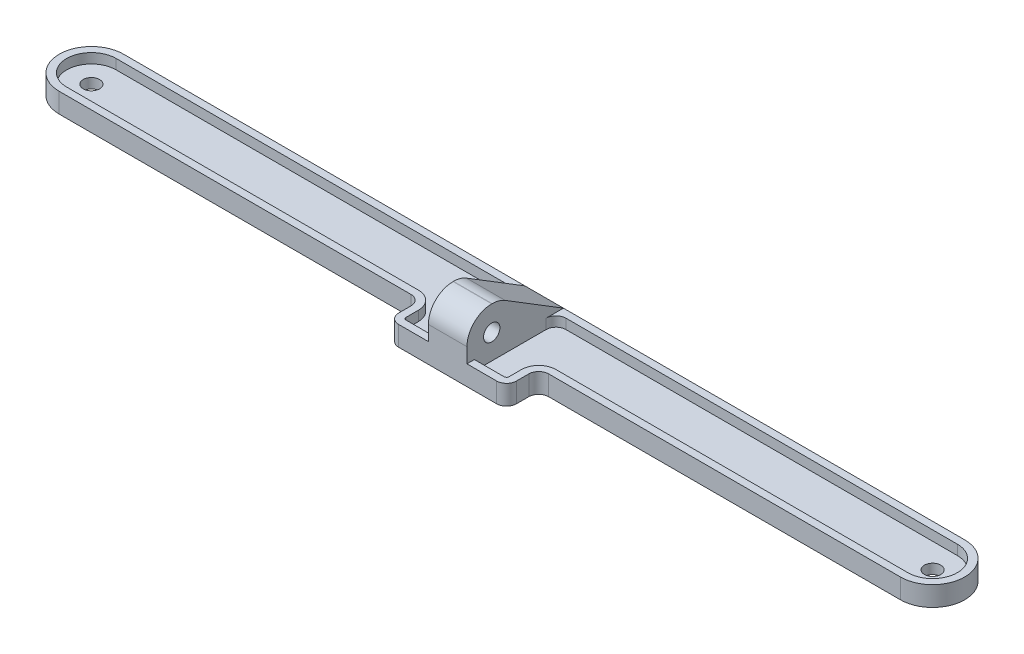
from build123d import *

# Parameters (mm, degrees)
SKETCH1_R               = 1.65
BOSS_EXTRUDE1_DEPTH     = 1
SKETCH2_W               = 7.8
SKETCH2_H               = 13
BOSS_EXTRUDE2_DEPTH     = 10
BOSS_EXTRUDE3_DEPTH     = 7.8
CUT_EXTRUDE1_DEPTH      = 97.907997606
CUT_EXTRUDE1_DEPTH_BACK = 97.907997606
SKETCH4_R               = 1.65
SKETCH7_W               = 8
SKETCH7_H               = 6.5
BOSS_EXTRUDE5_DEPTH     = 2
FILLET3_R               = 2
BOSS_EXTRUDE4_DEPTH     = 2
CUT_EXTRUDE2_DEPTH      = 10
FILLET1_R               = 5
FILLET2_R               = 2


with BuildPart() as part:
    # Sketch1 → Boss-Extrude1 (new, symmetric)
    with BuildSketch(Plane(origin=(0, 0, 0), x_dir=(1, 0, 0), z_dir=(0, 1, 0))):
        with BuildLine():
            Line((-85, 6.5), (85, 6.5))
            ThreePointArc((85, 6.5), (91.5, 0), (85, -6.5))
            Line((85, -6.5), (-85, -6.5))
            ThreePointArc((-85, -6.5), (-91.5, 0), (-85, 6.5))
        make_face()
        with Locations(Location((-85, 0, 0), (0, 0, 270))):
            Circle(SKETCH1_R, mode=Mode.SUBTRACT)
        with Locations(Location((85, 0, 0), (0, 0, 270))):
            Circle(SKETCH1_R, mode=Mode.SUBTRACT)
    extrude(amount=BOSS_EXTRUDE1_DEPTH, both=True)

    # Sketch2 → Boss-Extrude2 (add)
    with BuildSketch(Plane(origin=(0, 1, 0), x_dir=(1, 0, 0), z_dir=(0, 1, 0))):
        Rectangle(SKETCH2_W, SKETCH2_H)
    extrude(amount=BOSS_EXTRUDE2_DEPTH)

    # Sketch3 → Boss-Extrude3 (add)
    with BuildSketch(Plane(origin=(3.9, 0, 0), x_dir=(0, 0, -1), z_dir=(1, 0, 0))):
        with BuildLine():
            Line((-6.5, 11), (-8, 11))
            ThreePointArc((-8, 11), (-11.535533906, 9.535533906), (-13, 6))
            Line((-13, 6), (-13, -1))
            Line((-13, -1), (-6.5, -1))
            Line((-6.5, -1), (-6.5, 11))
        make_face()
    extrude(amount=-BOSS_EXTRUDE3_DEPTH)

    # Sketch4 → Cut-Extrude1 (cut, two sides: drawn at the far end of the back side and taken through both)
    with BuildSketch(Plane(origin=(3.9, 0, 0), x_dir=(0, 0, -1), z_dir=(1, 0, 0)).offset(-CUT_EXTRUDE1_DEPTH_BACK)):
        with Locations((-8, 6)):
            Circle(SKETCH4_R)
    extrude(amount=CUT_EXTRUDE1_DEPTH + CUT_EXTRUDE1_DEPTH_BACK, mode=Mode.SUBTRACT)

    # Sketch7 → Boss-Extrude5 (add)
    with BuildSketch(Plane(origin=(0, 1, 0), x_dir=(1, 0, 0), z_dir=(0, 1, 0))):
        with Locations((-7.9, -9.75)):
            Rectangle(SKETCH7_W, SKETCH7_H)
        with Locations((7.9, -9.75)):
            Rectangle(SKETCH7_W, SKETCH7_H)
    extrude(amount=-BOSS_EXTRUDE5_DEPTH)

    # Fillet3
    fillet3_edges = [part.edges().sort_by_distance(p)[0] for p in [
        (-11.9, 0, 6.5),
        (-11.9, 0, 13),
        (11.9, 0, 6.5),
        (11.9, 0, 13),
    ]]
    fillet(fillet3_edges, radius=FILLET3_R)

    # Sketch5 → Boss-Extrude4 (add)
    with BuildSketch(Plane(origin=(0, 1, 0), x_dir=(1, 0, 0), z_dir=(0, 1, 0))):
        with BuildLine():
            Line((-85, 6.5), (85, 6.5))
            ThreePointArc((85, 6.5), (91.5, 0), (85, -6.5))
            Line((85, -6.5), (13.9, -6.5))
            ThreePointArc((13.9, -6.5), (12.485786438, -7.085786438), (11.9, -8.5))
            Line((11.9, -8.5), (11.9, -11))
            ThreePointArc((11.9, -11), (11.314213562, -12.414213562), (9.9, -13))
            Line((9.9, -13), (-9.9, -13))
            ThreePointArc((-9.9, -13), (-11.314213562, -12.414213562), (-11.9, -11))
            Line((-11.9, -11), (-11.9, -8.5))
            ThreePointArc((-11.9, -8.5), (-12.485786438, -7.085786438), (-13.9, -6.5))
            Line((-13.9, -6.5), (-85, -6.5))
            ThreePointArc((-85, -6.5), (-91.5, 0), (-85, 6.5))
        make_face()
        with BuildLine():
            Line((-85, 5), (85, 5))
            ThreePointArc((85, 5), (90, 0), (85, -5))
            Line((85, -5), (13.9, -5))
            ThreePointArc((13.9, -5), (11.425126266, -6.025126266), (10.4, -8.5))
            Line((10.4, -8.5), (10.4, -11))
            ThreePointArc((10.4, -11), (10.253553391, -11.353553391), (9.9, -11.5))
            Line((9.9, -11.5), (-9.9, -11.5))
            ThreePointArc((-9.9, -11.5), (-10.253553391, -11.353553391), (-10.4, -11))
            Line((-10.4, -11), (-10.4, -8.5))
            ThreePointArc((-10.4, -8.5), (-11.425126266, -6.025126266), (-13.9, -5))
            Line((-13.9, -5), (-85, -5))
            ThreePointArc((-85, -5), (-90, 0), (-85, 5))
        make_face(mode=Mode.SUBTRACT)
    extrude(amount=BOSS_EXTRUDE4_DEPTH)

    # Sketch6 → Cut-Extrude2 (cut)
    with BuildSketch(Plane.ZY.offset(3.9)):
        Polygon((-6.5, 3), (6.5, 11), (-6.5, 11), align=None)
    extrude(amount=-CUT_EXTRUDE2_DEPTH, mode=Mode.SUBTRACT)

    # Fillet1
    fillet1_edges = [part.edges().sort_by_distance(p)[0] for p in [
        (0, 11, 6.5),
    ]]
    fillet(fillet1_edges, radius=FILLET1_R)

    # Fillet2
    fillet2_edges = [part.edges().sort_by_distance(p)[0] for p in [
        (-3.9, 2, -5),
        (3.9, 2, -5),
    ]]
    fillet(fillet2_edges, radius=FILLET2_R)


solid = part.part
